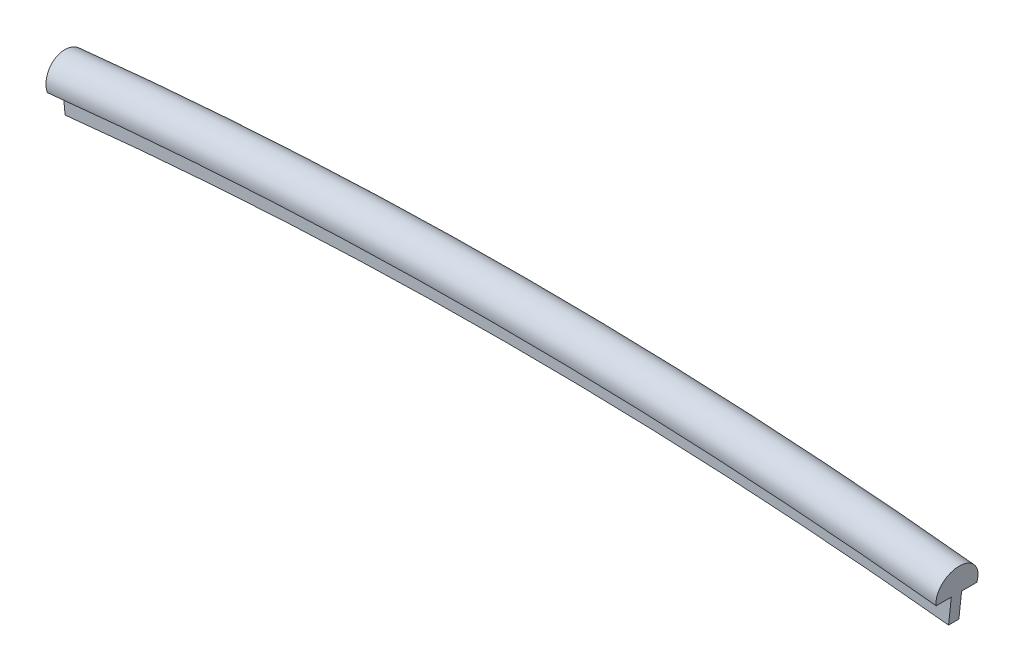
from build123d import *

# Parameters (mm, degrees)
REVOLVE1_ANGLE           = 6.145114075
REVOLVE1_OTHER_WAY_ANGLE = 6.145114075


with BuildPart() as part:
    # Sketch2 → Revolve1 (revolve)
    with BuildSketch(Plane(origin=(0, 0, 0), x_dir=(0, 0, -1), z_dir=(1, 0, 0))):
        with BuildLine():
            Line((0, 239.8), (0.3, 239.8))
            Line((0.3, 239.8), (0.3, 241.3))
            Line((0.3, 241.3), (1.18, 241.3))
            ThreePointArc((1.18, 241.3), (0, 242.800182019), (-1.18, 241.3))
            Line((-1.18, 241.3), (-0.3, 241.3))
            Line((-0.3, 241.3), (-0.3, 239.8))
            Line((-0.3, 239.8), (0, 239.8))
        make_face()
    revolve(axis=Axis((0, 0, 70.597641597), (0, 0, -1)), revolution_arc=REVOLVE1_ANGLE)

    # Sketch2 → Revolve1 other way (revolve)
    with BuildSketch(Plane(origin=(0, 0, 0), x_dir=(0, 0, -1), z_dir=(1, 0, 0))):
        with BuildLine():
            Line((0, 239.8), (0.3, 239.8))
            Line((0.3, 239.8), (0.3, 241.3))
            Line((0.3, 241.3), (1.18, 241.3))
            ThreePointArc((1.18, 241.3), (0, 242.800182019), (-1.18, 241.3))
            Line((-1.18, 241.3), (-0.3, 241.3))
            Line((-0.3, 241.3), (-0.3, 239.8))
            Line((-0.3, 239.8), (0, 239.8))
        make_face()
    revolve(axis=Axis((0, 0, 70.597641597), (0, 0, 1)), revolution_arc=REVOLVE1_OTHER_WAY_ANGLE)


solid = part.part
